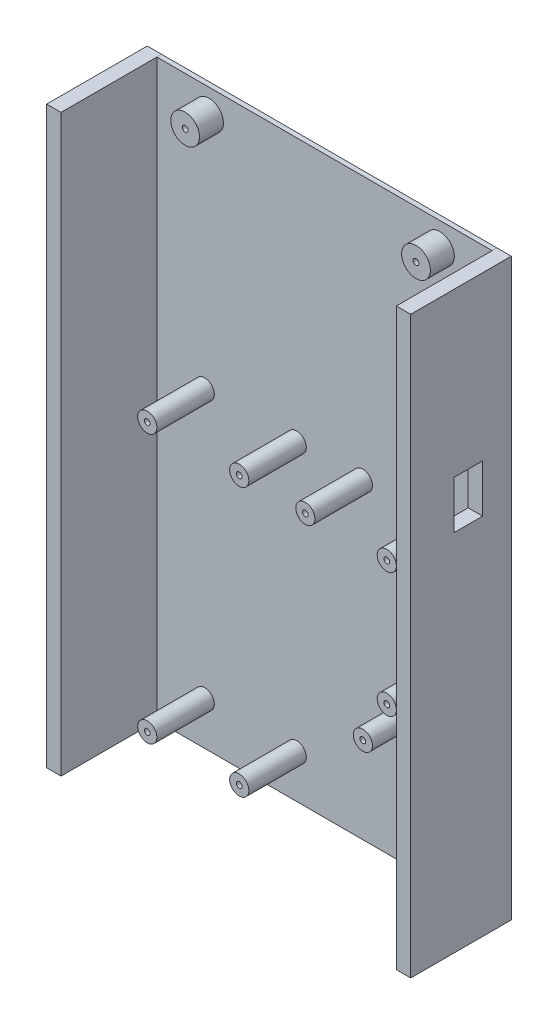
from build123d import *

# Parameters (mm, degrees)
SKICA1_W                       = 70
SKICA1_H                       = 120
P_IDAT_VYSUNUT_M1_DEPTH        = 1
SKICA2_R                       = 2
SKICA2_R_2                     = 0.6
SKICA2_R_3                     = 3
P_IDAT_VYSUNUT_M2_DEPTH        = 12
P_IDAT_VYSUNUT_M3_DEPTH        = 20
P_IDAT_VYSUNUT_M3_DEPTH_BACK   = 1
SKICA4_W                       = 3
SKICA4_H                       = 120
P_IDAT_VYSUNUT_M3_2_DEPTH      = 20
P_IDAT_VYSUNUT_M3_2_DEPTH_BACK = 1
SKICA5_W                       = 6
SKICA5_H                       = 10
ODEBRAT_VYSUNUT_M2_DEPTH       = 20
ODEBRAT_START                  = -7
SKICA6_R                       = 3
ODEBRAT_VYSUNUT_M3_DEPTH       = 7


with BuildPart() as part:
    # Skica1 → Přidat vysunutím1 (new body)
    with BuildSketch(Plane.XY):
        with Locations((35, 60)):
            Rectangle(SKICA1_W, SKICA1_H)
    extrude(amount=P_IDAT_VYSUNUT_M1_DEPTH)

    # Skica2 → Přidat vysunutím2 (add)
    # profile 1 of 10: a face of its own
    with BuildSketch(Plane.XY.offset(1)):
        with Locations(Location((10, 65, 0), (0, 0, 180))):
            Circle(SKICA2_R)
        with Locations((10, 65)):
            Circle(SKICA2_R_2, mode=Mode.SUBTRACT)
    # profile 2 of 10: a face of its own
    with BuildSketch(Plane.XY.offset(1)):
        with Locations(Location((29.2, 65, 0), (0, 0, 180))):
            Circle(SKICA2_R)
        with Locations((29.2, 65)):
            Circle(SKICA2_R_2, mode=Mode.SUBTRACT)
    # profile 3 of 10: a face of its own
    with BuildSketch(Plane.XY.offset(1)):
        with Locations(Location((43, 65, 0), (0, 0, 180))):
            Circle(SKICA2_R)
        with Locations((43, 65)):
            Circle(SKICA2_R_2, mode=Mode.SUBTRACT)
    # profile 4 of 10: a face of its own
    with BuildSketch(Plane.XY.offset(1)):
        with Locations(Location((60, 65, 0), (0, 0, 180))):
            Circle(SKICA2_R)
        with Locations((60, 65)):
            Circle(SKICA2_R_2, mode=Mode.SUBTRACT)
    # profile 5 of 10: a face of its own
    with BuildSketch(Plane.XY.offset(1)):
        with Locations(Location((60, 39, 0), (0, 0, 180))):
            Circle(SKICA2_R)
        with Locations((60, 39)):
            Circle(SKICA2_R_2, mode=Mode.SUBTRACT)
    # profile 6 of 10: a face of its own
    with BuildSketch(Plane.XY.offset(1)):
        with Locations(Location((55, 30, 0), (0, 0, 180))):
            Circle(SKICA2_R)
        with Locations((55, 30)):
            Circle(SKICA2_R_2, mode=Mode.SUBTRACT)
    # profile 7 of 10: a face of its own
    with BuildSketch(Plane.XY.offset(1)):
        with Locations(Location((29.2, 9, 0), (0, 0, 180))):
            Circle(SKICA2_R)
        with Locations((29.2, 9)):
            Circle(SKICA2_R_2, mode=Mode.SUBTRACT)
    # profile 8 of 10: a face of its own
    with BuildSketch(Plane.XY.offset(1)):
        with Locations(Location((10, 9.000006063, 0), (0, 0, 180))):
            Circle(SKICA2_R)
        with Locations((10, 9.000006063)):
            Circle(SKICA2_R_2, mode=Mode.SUBTRACT)
    # profile 9 of 10: a face of its own
    with BuildSketch(Plane.XY.offset(1)):
        with Locations(Location((10.9, 115, 0), (0, 0, 180))):
            Circle(SKICA2_R_3)
        with Locations((10.9, 115)):
            Circle(SKICA2_R_2, mode=Mode.SUBTRACT)
    # profile 10 of 10: a face of its own
    with BuildSketch(Plane.XY.offset(1)):
        with Locations(Location((59.1, 115, 0), (0, 0, 180))):
            Circle(SKICA2_R_3)
        with Locations((59.1, 115)):
            Circle(SKICA2_R_2, mode=Mode.SUBTRACT)
    extrude(amount=P_IDAT_VYSUNUT_M2_DEPTH)

    # Skica6 → Odebrat vysunutím3 (cut)
    with BuildSketch(Plane.XY.offset(13).offset(ODEBRAT_START)):
        with Locations(Location((10.9, 115, 0), (0, 0, 180))):
            Circle(SKICA6_R)
        with Locations(Location((59.1, 115, 0), (0, 0, 180))):
            Circle(SKICA6_R)
    extrude(amount=ODEBRAT_VYSUNUT_M3_DEPTH, mode=Mode.SUBTRACT)


with BuildPart() as body_2:
    # Skica4 → Přidat vysunutím3 (new, two sides: drawn at the far end of the back side and taken through both)
    with BuildSketch(Plane.XY.offset(1).offset(-P_IDAT_VYSUNUT_M3_DEPTH_BACK)):
        with Locations((-1.5, 60)):
            Rectangle(SKICA4_W, SKICA4_H)
    extrude(amount=P_IDAT_VYSUNUT_M3_DEPTH + P_IDAT_VYSUNUT_M3_DEPTH_BACK)


with BuildPart() as body_3:
    # Skica4 → P_idat vysunut_m3 2 (new, two sides: drawn at the far end of the back side and taken through both)
    with BuildSketch(Plane.XY.offset(1).offset(-P_IDAT_VYSUNUT_M3_2_DEPTH_BACK)):
        with Locations((71.5, 60)):
            Rectangle(SKICA4_W, SKICA4_H)
    extrude(amount=P_IDAT_VYSUNUT_M3_2_DEPTH + P_IDAT_VYSUNUT_M3_2_DEPTH_BACK)

    # Skica5 → Odebrat vysunutím2 (cut)
    with BuildSketch(Plane(origin=(73, 0, 0), x_dir=(0, 0, -1), z_dir=(1, 0, 0))):
        with Locations((-9, 81)):
            Rectangle(SKICA5_W, SKICA5_H)
    extrude(amount=-ODEBRAT_VYSUNUT_M2_DEPTH, mode=Mode.SUBTRACT)


solid = Compound([part.part, body_2.part, body_3.part])
